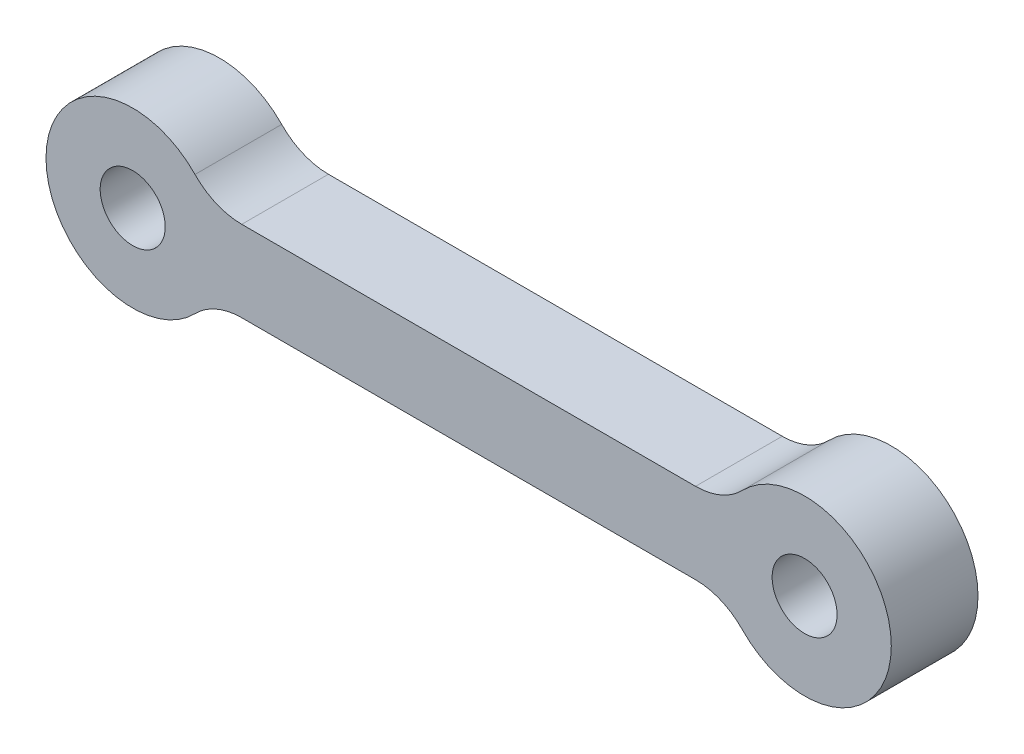
from build123d import *

# Parameters (mm, degrees)
SKETCH1_R           = 1.5
BOSS_EXTRUDE1_DEPTH = 4


with BuildPart() as part:
    # Sketch1 → Boss-Extrude1 (new body)
    with BuildSketch(Plane.XY):
        with BuildLine():
            Line((-10.468793822, 1.866925558), (10.468793822, 1.866925558))
            ThreePointArc((10.468793822, 1.866925558), (11.639802849, 2.104908567), (12.625025041, 2.781100319))
            ThreePointArc((12.625025041, 2.781100319), (19.5, 0), (12.625025041, -2.781100319))
            ThreePointArc((12.625025041, -2.781100319), (11.639802849, -2.104908567), (10.468793822, -1.866925558))
            Line((10.468793822, -1.866925558), (-10.468793822, -1.866925558))
            ThreePointArc((-10.468793822, -1.866925558), (-11.639802849, -2.104908567), (-12.625025041, -2.781100319))
            ThreePointArc((-12.625025041, -2.781100319), (-19.5, 0), (-12.625025041, 2.781100319))
            ThreePointArc((-12.625025041, 2.781100319), (-11.639802849, 2.104908567), (-10.468793822, 1.866925558))
        make_face()
        with Locations((-15.5, 0)):
            Circle(SKETCH1_R, mode=Mode.SUBTRACT)
        with Locations(Location((15.5, 0, 0), (0, 0, 180))):
            Circle(SKETCH1_R, mode=Mode.SUBTRACT)
    extrude(amount=BOSS_EXTRUDE1_DEPTH)


solid = part.part
